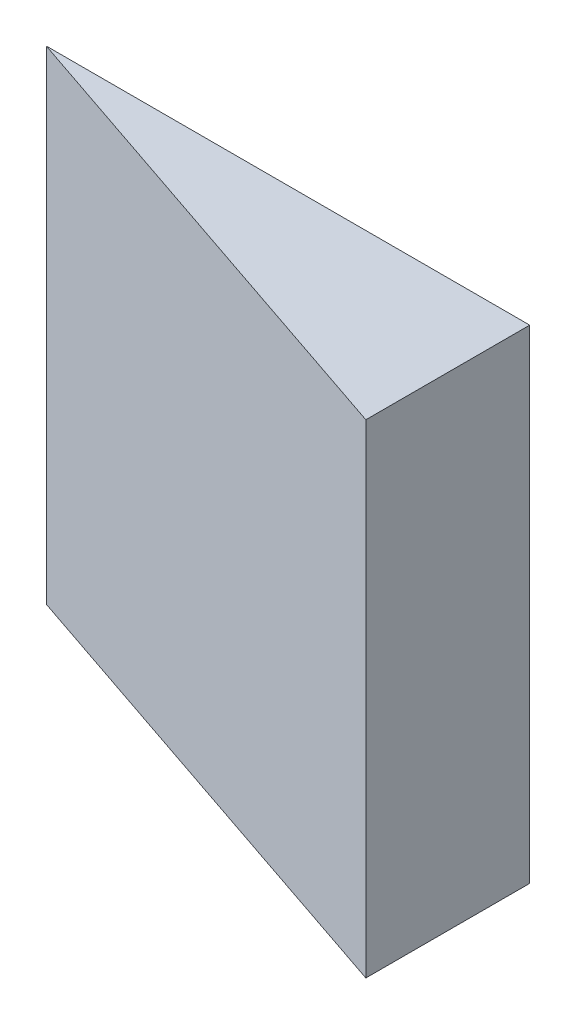
from build123d import *

# Parameters (mm, degrees)
BOSS_EXTRUDE2_DEPTH = 74.93


with BuildPart() as part:
    # Sketch1 → Boss-Extrude2 (new body)
    with BuildSketch(Plane(origin=(0, 0, 0), x_dir=(1, 0, 0), z_dir=(0, 1, 0))):
        Polygon((-9.902883232, 34.190845126), (65.027116768, 34.190845126), (65.027116768, 8.790845126), align=None)
    extrude(amount=BOSS_EXTRUDE2_DEPTH)


solid = part.part
